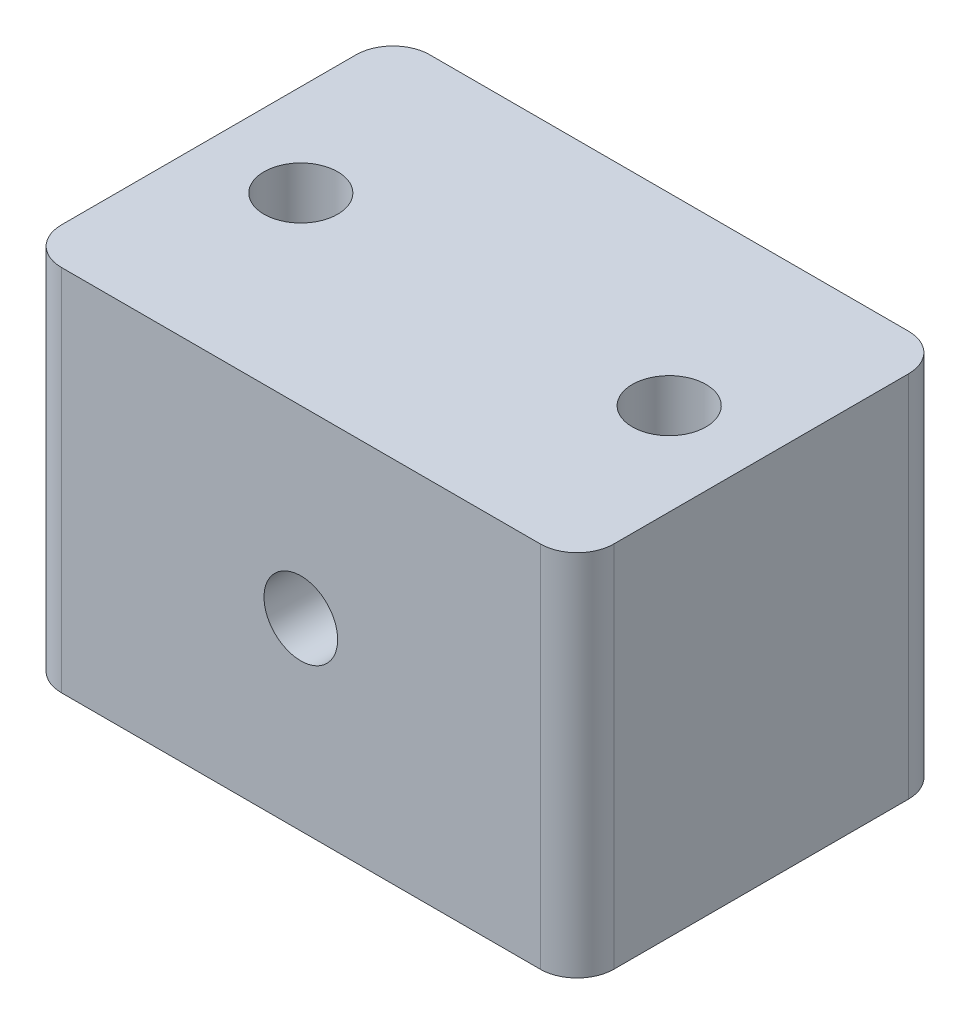
from build123d import *

# Parameters (mm, degrees)
CROQUIS1_W              = 15
CROQUIS1_H              = 10
CROQUIS1_R              = 1
SALIENTE_EXTRUIR1_DEPTH = 10
CROQUIS2_R              = 1
CORTAR_EXTRUIR1_DEPTH   = 10
REDONDEO1_R             = 1


with BuildPart() as part:
    # Croquis1 → Saliente-Extruir1 (new body)
    with BuildSketch(Plane.XY):
        with Locations((-10.722064782, 5.272312164)):
            Rectangle(CROQUIS1_W, CROQUIS1_H)
        with Locations((-10.722064782, 5.272312164)):
            Circle(CROQUIS1_R, mode=Mode.SUBTRACT)
    extrude(amount=SALIENTE_EXTRUIR1_DEPTH)

    # Croquis2 → Cortar-Extruir1 (cut)
    with BuildSketch(Plane(origin=(0, 10.272312164, 0), x_dir=(-1, 0, 0), z_dir=(0, 1, 0))):
        with Locations(Location((15.722064782, 5, 0), (0, 0, 90))):
            Circle(CROQUIS2_R)
        with Locations(Location((5.722064782, 5, 0), (0, 0, 90))):
            Circle(CROQUIS2_R)
    extrude(amount=-CORTAR_EXTRUIR1_DEPTH, mode=Mode.SUBTRACT)

    # Redondeo1
    redondeo1_edges = [part.edges().sort_by_distance(p)[0] for p in [
        (-3.222064782, 5.272312164, 10),
        (-18.222064782, 5.272312164, 10),
        (-3.222064782, 5.272312164, 0),
        (-18.222064782, 5.272312164, 0),
    ]]
    fillet(redondeo1_edges, radius=REDONDEO1_R)


solid = part.part
